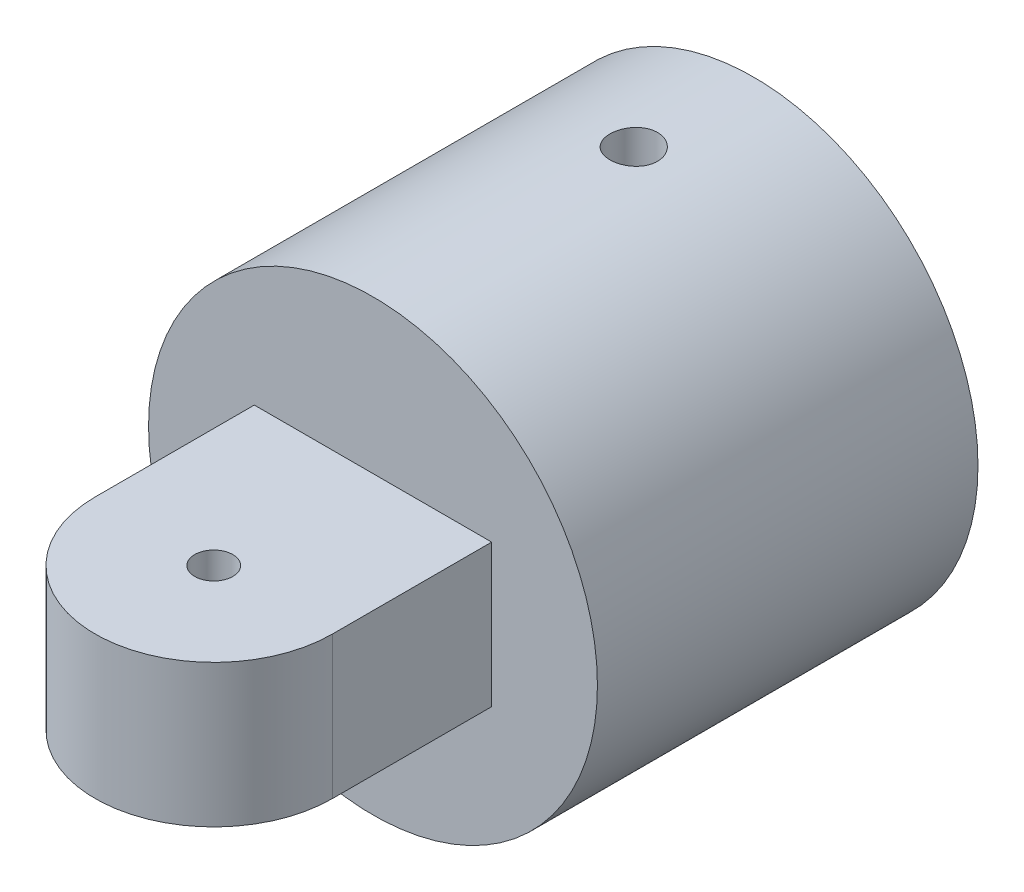
from build123d import *

# Parameters (mm, degrees)
RESSALTO_EXTRUS_O1_DEPTH      = 30
RESSALTO_EXTRUS_O1_DEPTH_BACK = 10
ESBO_O1_R                     = 23.59
RESSALTO_EXTRUS_O2_DEPTH      = 7.49
ESBO_O3_R                     = 2
CORTE_EXTRUS_O1_DEPTH         = 37.5
CUT_EXTRUDE1_DEPTH            = 68.960216691
CUT_EXTRUDE1_DEPTH_BACK       = 68.960216691
SKETCH1_R                     = 2.5


with BuildPart() as part:
    # Esboço1 → Ressalto-extrusão1 (new, two sides: drawn at the far end of the back side and taken through both)
    with BuildSketch(Plane.XY.offset(-RESSALTO_EXTRUS_O1_DEPTH_BACK)):
        Circle(ESBO_O1_R)
    extrude(amount=RESSALTO_EXTRUS_O1_DEPTH + RESSALTO_EXTRUS_O1_DEPTH_BACK)

    # Sketch1 → Cut-Extrude1 (cut, two sides: drawn at the far end of the back side and taken through both)
    with BuildSketch(Plane(origin=(0, 0, 0), x_dir=(1, 0, 0), z_dir=(0, 1, 0)).offset(-CUT_EXTRUDE1_DEPTH_BACK)):
        with Locations(Location((0, -2.59265528, 0), (0, 0, 270))):
            Circle(SKETCH1_R)
    extrude(amount=CUT_EXTRUDE1_DEPTH + CUT_EXTRUDE1_DEPTH_BACK, mode=Mode.SUBTRACT)


with BuildPart() as body_2:
    # Esboço2 → Ressalto-extrusão2 (new, symmetric)
    with BuildSketch(Plane(origin=(0, 0, 0), x_dir=(1, 0, 0), z_dir=(0, 1, 0))):
        with BuildLine():
            Line((-12.473507345, -30), (12.473507345, -30))
            Line((12.473507345, -30), (12.473507345, -46.734725635))
            ThreePointArc((12.473507345, -46.734725635), (0, -59.20823298), (-12.473507345, -46.734725635))
            Line((-12.473507345, -46.734725635), (-12.473507345, -30))
        make_face()
    extrude(amount=RESSALTO_EXTRUS_O2_DEPTH, both=True)

    # Esboço3 → Corte-extrusão1 (cut, symmetric)
    with BuildSketch(Plane(origin=(0, 7.49, 0), x_dir=(1, 0, 0), z_dir=(0, 1, 0))):
        with Locations(Location((0, -46.734725635, 0), (0, 0, 270))):
            Circle(ESBO_O3_R)
    extrude(amount=CORTE_EXTRUS_O1_DEPTH, both=True, mode=Mode.SUBTRACT)


solid = Compound([part.part, body_2.part])
